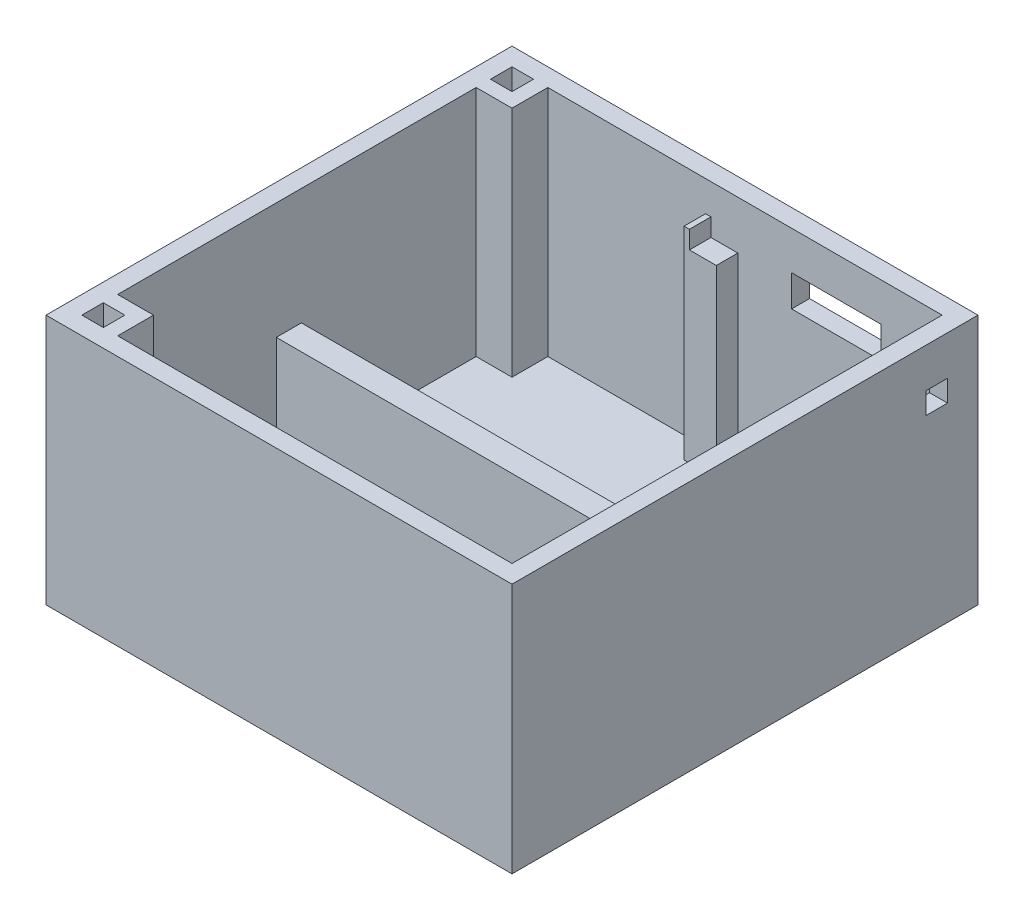
from build123d import *

# Parameters (mm, degrees)
SKIZZE1_W                         = 48
SKIZZE1_H                         = 48
AUFSATZ_LINEAR_AUSTRAGEN1_DEPTH   = 2
LINEAR_AUSTRAGEN_D_NN1_DEPTH      = 26
LINEAR_AUSTRAGEN_D_NN1_DEPTH_BACK = 2
SKIZZE2_W                         = 52
SKIZZE2_H                         = 52
SKIZZE2_W_2                       = 48
SKIZZE2_H_2                       = 48
SCHNITT_LINEAR_AUSTRAGEN1_REACH   = 66.529
SKIZZE4_W                         = 10
SKIZZE4_H                         = 3.5
SCHNITT_LINEAR_AUSTRAGEN2_REACH   = 66.529
SKIZZE5_W                         = 2.4
SKIZZE5_H                         = 2.4
SKIZZE6_W                         = 3
SKIZZE6_H                         = 4.8
AUFSATZ_LINEAR_AUSTRAGEN2_DEPTH   = 19.1
SKIZZE7_W                         = 3.6
SKIZZE7_H                         = 2.4
AUFSATZ_LINEAR_AUSTRAGEN3_DEPTH   = 20.6
SKIZZE8_W                         = 0.6
SKIZZE8_H                         = 2.4
AUFSATZ_LINEAR_AUSTRAGEN4_DEPTH   = 2
SKIZZE9_W                         = 37
SKIZZE9_H                         = 2.6
AUFSATZ_LINEAR_AUSTRAGEN5_DEPTH   = 20.6
AUFSATZ_LINEAR_AUSTRAGEN6_DEPTH   = 26
SKIZZE11_W                        = 37
SKIZZE11_H                        = 2.8
AUFSATZ_LINEAR_AUSTRAGEN7_DEPTH   = 24


with BuildPart() as part:
    # Skizze1 → Aufsatz-Linear austragen1 (new body)
    with BuildSketch(Plane(origin=(0, 0, 0), x_dir=(1, 0, 0), z_dir=(0, 1, 0))):
        Rectangle(SKIZZE1_W, SKIZZE1_H)
    extrude(amount=AUFSATZ_LINEAR_AUSTRAGEN1_DEPTH)

    # Skizze2 → Linear-Austragen-Dünn1 (add, two sides: drawn at the far end of the back side and taken through both)
    with BuildSketch(Plane(origin=(0, 2, 0), x_dir=(1, 0, 0), z_dir=(0, 1, 0)).offset(-LINEAR_AUSTRAGEN_D_NN1_DEPTH_BACK)):
        Rectangle(SKIZZE2_W, SKIZZE2_H)
        Rectangle(SKIZZE2_W_2, SKIZZE2_H_2, mode=Mode.SUBTRACT)
    extrude(amount=LINEAR_AUSTRAGEN_D_NN1_DEPTH + LINEAR_AUSTRAGEN_D_NN1_DEPTH_BACK)

    # Skizze4 → Schnitt-Linear austragen1 (cut, up to next)
    with BuildSketch(Plane(origin=(0, 0, -26), x_dir=(-1, 0, 0), z_dir=(0, 0, -1)), mode=Mode.PRIVATE) as schnitt_linear_austragen1_sk1:
        with Locations((-12.2, 21.95)):
            Rectangle(SKIZZE4_W, SKIZZE4_H)
    schnitt_linear_austragen1_tool1 = extrude(schnitt_linear_austragen1_sk1.sketch, amount=-SCHNITT_LINEAR_AUSTRAGEN1_REACH, mode=Mode.PRIVATE) & part.part
    add(schnitt_linear_austragen1_tool1.solids().sort_by_distance((12.2, 21.95, -26))[0], mode=Mode.SUBTRACT)

    # Skizze5 → Schnitt-Linear austragen2 (cut, up to next)
    with BuildSketch(Plane(origin=(26, 0, 0), x_dir=(0, 0, -1), z_dir=(1, 0, 0)), mode=Mode.PRIVATE) as schnitt_linear_austragen2_sk1:
        with Locations((21.4, 22.4)):
            Rectangle(SKIZZE5_W, SKIZZE5_H)
    schnitt_linear_austragen2_tool1 = extrude(schnitt_linear_austragen2_sk1.sketch, amount=-SCHNITT_LINEAR_AUSTRAGEN2_REACH, mode=Mode.PRIVATE) & part.part
    add(schnitt_linear_austragen2_tool1.solids().sort_by_distance((26, 22.4, -21.4))[0], mode=Mode.SUBTRACT)

    # Skizze6 → Aufsatz-Linear austragen2 (add)
    with BuildSketch(Plane(origin=(0, 2, 0), x_dir=(1, 0, 0), z_dir=(0, 1, 0))):
        with Locations((20.5, 19)):
            Rectangle(SKIZZE6_W, SKIZZE6_H)
    extrude(amount=AUFSATZ_LINEAR_AUSTRAGEN2_DEPTH)

    # Skizze7 → Aufsatz-Linear austragen3 (add)
    with BuildSketch(Plane(origin=(0, 2, 0), x_dir=(1, 0, 0), z_dir=(0, 1, 0))):
        with Locations((-0.6, 22.8)):
            Rectangle(SKIZZE7_W, SKIZZE7_H)
    extrude(amount=AUFSATZ_LINEAR_AUSTRAGEN3_DEPTH)

    # Skizze8 → Aufsatz-Linear austragen4 (add)
    with BuildSketch(Plane(origin=(0, 22.6, 0), x_dir=(1, 0, 0), z_dir=(0, 1, 0))):
        with Locations((-2.1, 22.8)):
            Rectangle(SKIZZE8_W, SKIZZE8_H)
    extrude(amount=AUFSATZ_LINEAR_AUSTRAGEN4_DEPTH)

    # Skizze9 → Aufsatz-Linear austragen5 (add)
    with BuildSketch(Plane(origin=(0, 2, 0), x_dir=(1, 0, 0), z_dir=(0, 1, 0))):
        with Locations((5.5, -9.2)):
            Rectangle(SKIZZE9_W, SKIZZE9_H)
    extrude(amount=AUFSATZ_LINEAR_AUSTRAGEN5_DEPTH)

    # Skizze10 → Aufsatz-Linear austragen6 (add)
    with BuildSketch(Plane(origin=(0, 2, 0), x_dir=(1, 0, 0), z_dir=(0, 1, 0))):
        Polygon((-24, 21.6), (-21.6, 21.6), (-21.6, 24), (-20, 24), (-20, 20), (-24, 20), align=None)
        Polygon((-24, -21.6), (-21.6, -21.6), (-21.6, -24), (-20, -24), (-20, -20), (-24, -20), align=None)
    extrude(amount=AUFSATZ_LINEAR_AUSTRAGEN6_DEPTH)

    # Skizze11 → Aufsatz-Linear austragen7 (add)
    with BuildSketch(Plane(origin=(0, 2, 0), x_dir=(1, 0, 0), z_dir=(0, 1, 0))):
        with Locations((5.5, -11.9)):
            Rectangle(SKIZZE11_W, SKIZZE11_H)
    extrude(amount=AUFSATZ_LINEAR_AUSTRAGEN7_DEPTH)


solid = part.part
